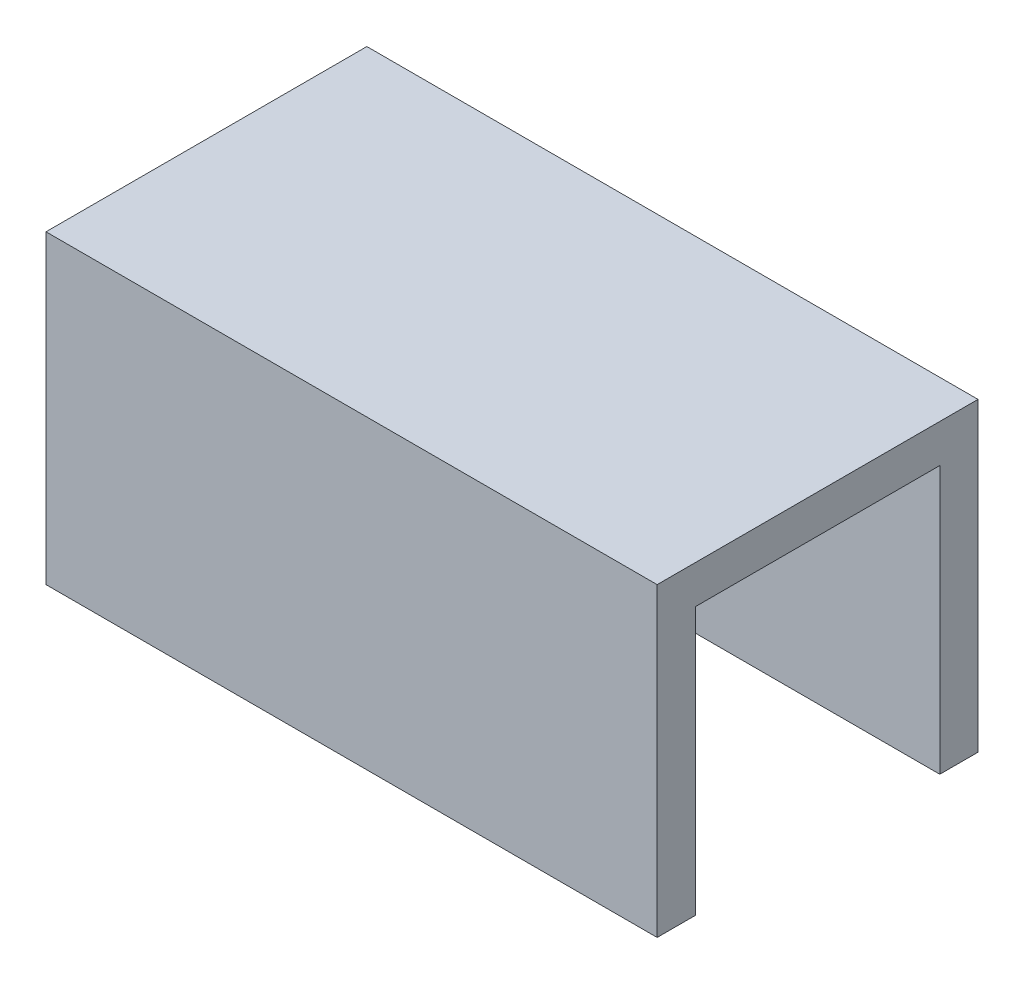
from build123d import *

# Parameters (mm, degrees)
BOSS_EXTRUDE1_DEPTH = 20
BOSS_EXTRUDE2_REACH = 35.797


with BuildPart() as part:
    # Sketch1 → Boss-Extrude1 (new, symmetric)
    with BuildSketch(Plane(origin=(0, 0, 0), x_dir=(0, 0, -1), z_dir=(1, 0, 0))):
        Polygon((-8, 0), (-8, 17.5), (8, 17.5), (8, 0), (10.5, 0), (10.5, 20), (-10.5, 20), (-10.5, 0), align=None)
    extrude(amount=BOSS_EXTRUDE1_DEPTH, both=True)

    # Sketch2 → Boss-Extrude2 (add, up to next)
    with BuildSketch(Plane(origin=(0, 0, 8), x_dir=(-1, 0, 0), z_dir=(0, 0, -1)), mode=Mode.PRIVATE) as boss_extrude2_sk1:
        with BuildLine():
            Line((20, 17.5), (20, 20))
            Line((20, 20), (-20, 20))
            Line((-20, 20), (-20, 17.5))
            ThreePointArc((-20, 17.5), (0, 9.985297678), (20, 17.5))
        make_face()
    boss_extrude2_tool1 = extrude(boss_extrude2_sk1.sketch, amount=BOSS_EXTRUDE2_REACH, mode=Mode.PRIVATE) - part.part
    add(boss_extrude2_tool1.solids().sort_by_distance((0, 15.86208, 8))[0])


solid = part.part
